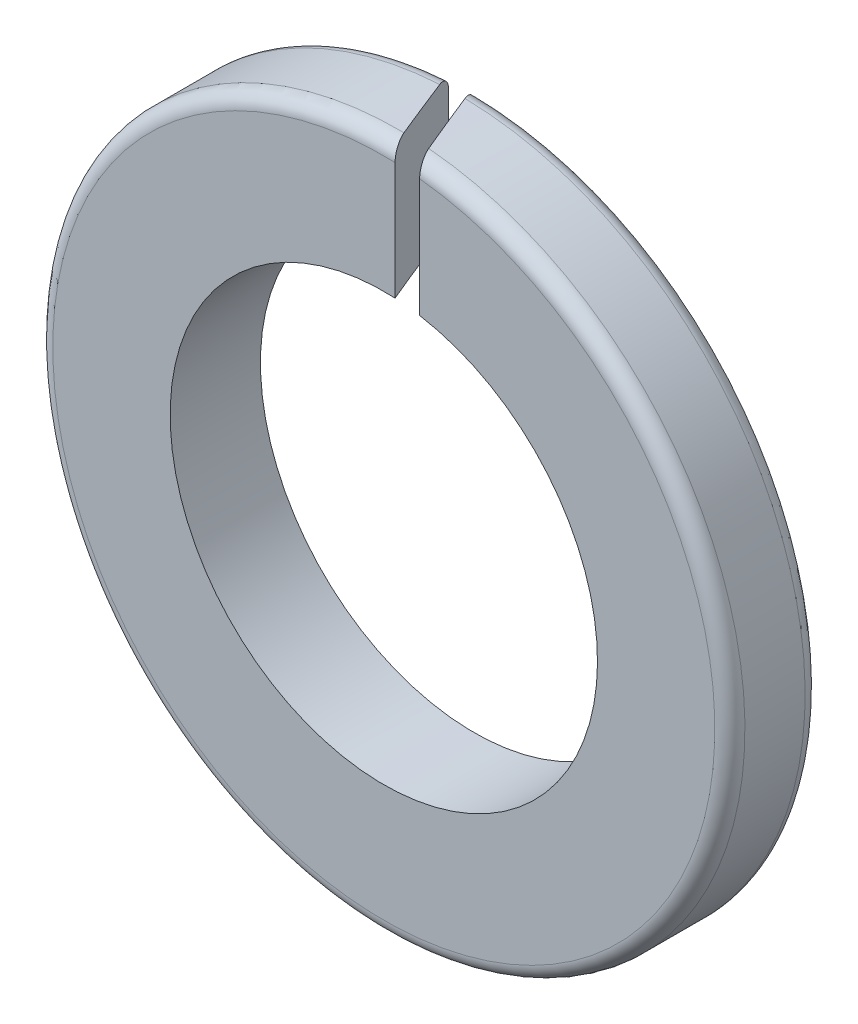
from build123d import *

# Parameters (mm, degrees)
ESQUISSE1_R             = 11.5
ESQUISSE1_R_2           = 7.1
EXTRUSION1_DEPTH        = 3
CONG_2_R                = 0.5
ENL_V_MAT_EXTRU_1_DEPTH = 17.537835548


with BuildPart() as part:
    # Esquisse1 → Extrusion1 (new body)
    with BuildSketch(Plane.XY):
        Circle(ESQUISSE1_R)
        Circle(ESQUISSE1_R_2, mode=Mode.SUBTRACT)
    extrude(amount=EXTRUSION1_DEPTH)

    # Congé2
    cong_2_edges = [part.edges().sort_by_distance(p)[0] for p in [
        (-11.5, 0, 0),
        (-11.5, 0, 3),
    ]]
    fillet(cong_2_edges, radius=CONG_2_R)

    # Esquisse2 → Enlèv. mat.-Extru.1 (cut, through all)
    with BuildSketch(Plane(origin=(0, 0, 0), x_dir=(1, 0, 0), z_dir=(0, 1, 0))):
        Polygon((-0.862634787, 2.166197843), (1.536568214, -3.872245663), (0.727848101, -3.872245663), (-1.725269573, 2.166197843), align=None)
    extrude(amount=ENL_V_MAT_EXTRU_1_DEPTH, mode=Mode.SUBTRACT)


solid = part.part
